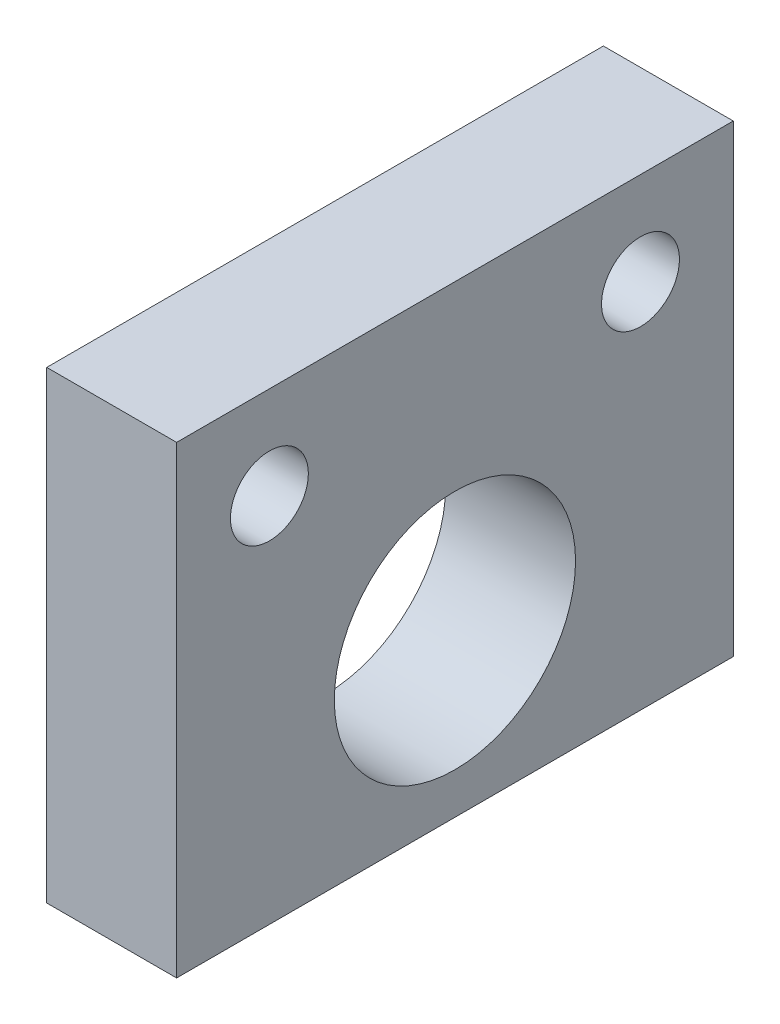
from build123d import *

# Parameters (mm, degrees)
SKETCH2_W             = 7
SKETCH2_H             = 30
BOSS_EXTRUDE1_DEPTH   = 25
SKETCH5_R             = 6.5
CUT_EXTRUDE1_DEPTH    = 7
M5X0_8_TAPPED_HOLE2_D = 4.2


with BuildPart() as part:
    # Sketch2 → Boss-Extrude1 (new body)
    with BuildSketch(Plane(origin=(0, 0, 0), x_dir=(1, 0, 0), z_dir=(0, 1, 0))):
        Rectangle(SKETCH2_W, SKETCH2_H)
    extrude(amount=BOSS_EXTRUDE1_DEPTH)

    # Sketch5 → Cut-Extrude1 (cut)
    with BuildSketch(Plane(origin=(3.5, 0, 0), x_dir=(0, 0, -1), z_dir=(1, 0, 0))):
        with Locations((0, 8.72)):
            Circle(SKETCH5_R)
    extrude(amount=-CUT_EXTRUDE1_DEPTH, mode=Mode.SUBTRACT)

    # M5x0.8 Tapped Hole2 (through all)
    with Locations(Plane(origin=(3.5, 0, 0), x_dir=(0, 0, -1), z_dir=(1, 0, 0))):
        with Locations((10, 20), (-10, 20)):
            Hole(M5X0_8_TAPPED_HOLE2_D / 2)


solid = part.part
